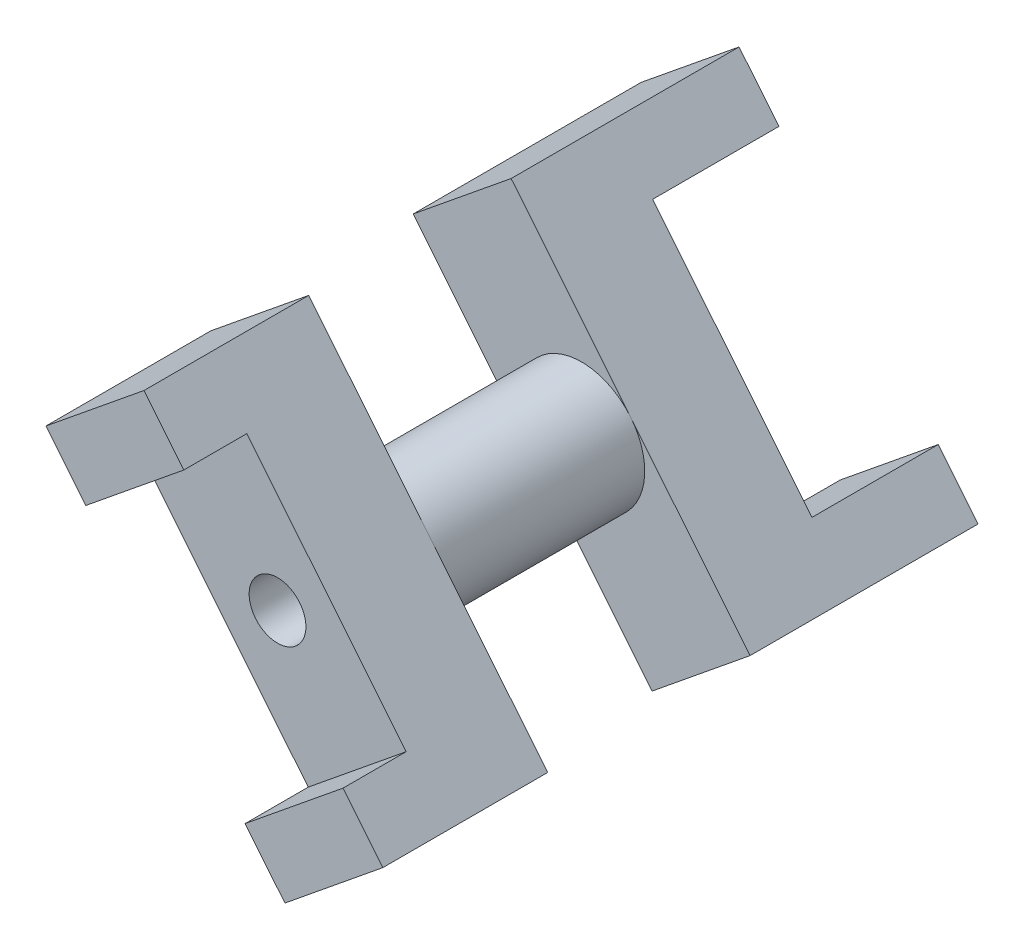
from build123d import *

# Parameters (mm, degrees)
SKETCH1_R           = 3
SKETCH1_R_2         = 1.35
BOSS_EXTRUDE1_DEPTH = 19.293356838
BOSS_EXTRUDE2_DEPTH = 6
CUT_EXTRUDE1_START  = -4
SKETCH3_R           = 1.35
CUT_EXTRUDE1_DEPTH  = 4
SKETCH4_R           = 1.35
CUT_EXTRUDE2_DEPTH  = 4


with BuildPart() as part:
    # Sketch1 → Boss-Extrude1 (new body)
    with BuildSketch(Plane.XY):
        Circle(SKETCH1_R)
        with Locations(Location((0, 0, 0), (0, 0, 39.125701285))):
            Circle(SKETCH1_R_2, mode=Mode.SUBTRACT)
    extrude(amount=BOSS_EXTRUDE1_DEPTH)

    # Sketch2 → Boss-Extrude2 (add)
    with BuildSketch(Plane(origin=(-2.327290276, -1.89307157, 0), x_dir=(0, 0, 1), z_dir=(-0.7757634254674072, -0.6310238566861593, 0))):
        Polygon((14.457294983, 3), (14.457294983, -3), (14.457294983, -9), (19.293356838, -9), (22.293356838, -9), (22.293356838, -6), (19.293356838, -6), (19.293356838, -3), (19.293356838, 3), (19.293356838, 6), (22.293356838, 6), (22.293356838, 9), (19.293356838, 9), (14.457294983, 9), align=None)
        Polygon((0, -9), (-3, -9), (-6, -9), (-6, -6), (-3, -6), (0, -6), (0, -3), (0, 3), (0, 6), (-3, 6), (-6, 6), (-6, 9), (-3, 9), (0, 9), (4.836061855, 9), (4.836061855, 3), (4.836061855, -3), (4.836061855, -9), align=None)
    extrude(amount=-BOSS_EXTRUDE2_DEPTH)

    # Sketch3 → Cut-Extrude1 (cut)
    with BuildSketch(Plane.XY.offset(19.293356838).offset(CUT_EXTRUDE1_START)):
        Circle(SKETCH3_R)
    extrude(amount=CUT_EXTRUDE1_DEPTH, mode=Mode.SUBTRACT)

    # Sketch4 → Cut-Extrude2 (cut)
    with BuildSketch(Plane(origin=(0, 0, 0), x_dir=(-1, 0, 0), z_dir=(0, 0, -1))):
        with Locations(Location((0, 0, 0), (0, 0, 180))):
            Circle(SKETCH4_R)
    extrude(amount=-CUT_EXTRUDE2_DEPTH, mode=Mode.SUBTRACT)


solid = part.part
